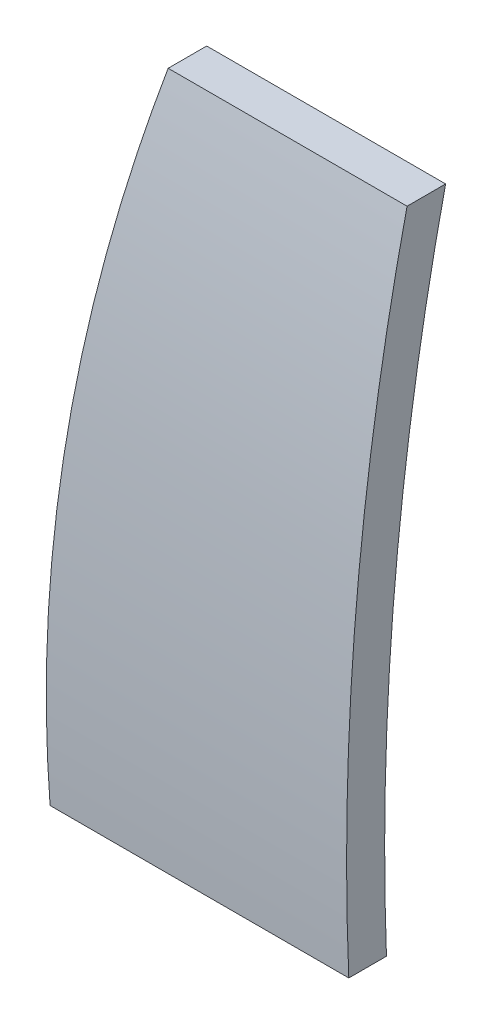
from build123d import *

# Parameters (mm, degrees)
BOSS_EXTRUDE1_DEPTH     = 254
CUT_EXTRUDE1_DEPTH      = 1453.231074317
CUT_EXTRUDE1_DEPTH_BACK = 1453.231074317


with BuildPart() as part:
    # Sketch1 → Boss-Extrude1 (new, symmetric)
    with BuildSketch(Plane.XY):
        with BuildLine():
            Line((121.1841308, 1295.4), (605.3081308, 1295.4))
            Line((605.3081308, 1295.4), (605.3081308, 0))
            Line((605.3081308, 0), (0, 0))
            ThreePointArc((0, 0), (18.628876548, 651.62563885), (121.1841308, 1295.4))
        make_face()
    extrude(amount=BOSS_EXTRUDE1_DEPTH, both=True)

    # Sketch2 → Cut-Extrude1 (cut, two sides: drawn at the far end of the back side and taken through both)
    with BuildSketch(Plane(origin=(0, 0, 0), x_dir=(0, 0, -1), z_dir=(1, 0, 0)).offset(-CUT_EXTRUDE1_DEPTH_BACK)):
        with BuildLine():
            Line((196.186778864, 1295.4), (254, 1295.4))
            Line((254, 1295.4), (254, 0))
            Line((254, 0), (76.26716522, 0))
            ThreePointArc((76.26716522, 0), (93.965970842, 651.612245589), (196.186778864, 1295.4))
        make_face()
        with BuildLine():
            ThreePointArc((118.0703125, 1295.4), (15.664285855, 651.653074125), (0, 0))
            Line((0, 0), (-254, 0))
            Line((-254, 0), (-254, 1295.4))
            Line((-254, 1295.4), (118.0703125, 1295.4))
        make_face()
    extrude(amount=CUT_EXTRUDE1_DEPTH + CUT_EXTRUDE1_DEPTH_BACK, mode=Mode.SUBTRACT)


solid = part.part
